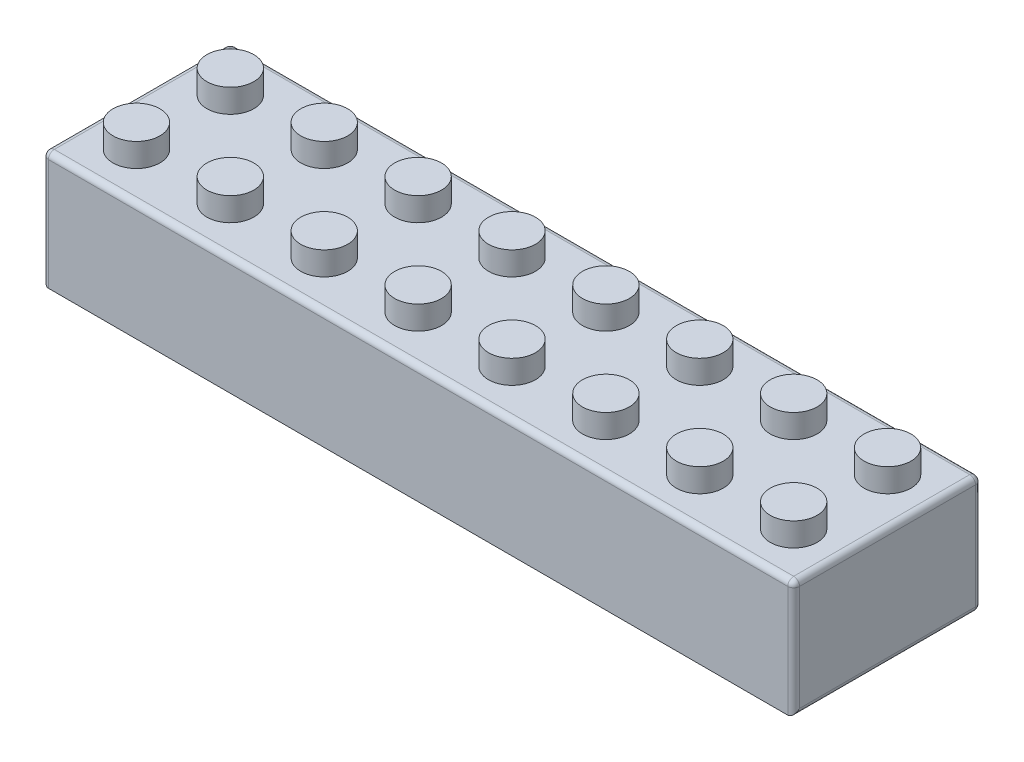
from build123d import *

# Parameters (mm, degrees)
BOSS_EXTRUDE1_DEPTH      = 8
BOSS_EXTRUDE1_DEPTH_BACK = 8
SKETCH1_W                = 64
SKETCH1_H                = 10
SKETCH2_R                = 2
BOSS_EXTRUDE2_DEPTH      = 2
SHELL1_T                 = -1
SKETCH3_R                = 3.772610986
SKETCH3_R_2              = 2.772610986
BOSS_EXTRUDE3_DEPTH      = 9
FILLET1_R                = 0.5


with BuildPart() as part:
    # Sketch1 → Boss-Extrude1 (new, two sides: drawn at the far end of the back side and taken through both)
    with BuildSketch(Plane.XY.offset(-BOSS_EXTRUDE1_DEPTH_BACK)):
        Rectangle(SKETCH1_W, SKETCH1_H)
    extrude(amount=BOSS_EXTRUDE1_DEPTH + BOSS_EXTRUDE1_DEPTH_BACK)

    # Sketch2 → Boss-Extrude2 (add)
    with BuildSketch(Plane(origin=(0, 5, 0), x_dir=(1, 0, 0), z_dir=(0, 1, 0))):
        with Locations((-28, 4)):
            Circle(SKETCH2_R)
        with Locations((-20, 4)):
            Circle(SKETCH2_R)
        with Locations((-12, 4)):
            Circle(SKETCH2_R)
        with Locations((-4, 4)):
            Circle(SKETCH2_R)
        with Locations((4, 4)):
            Circle(SKETCH2_R)
        with Locations((12, 4)):
            Circle(SKETCH2_R)
        with Locations((20, 4)):
            Circle(SKETCH2_R)
        with Locations((28, 4)):
            Circle(SKETCH2_R)
        with Locations((-20, -4)):
            Circle(SKETCH2_R)
        with Locations((-12, -4)):
            Circle(SKETCH2_R)
        with Locations((-4, -4)):
            Circle(SKETCH2_R)
        with Locations((4, -4)):
            Circle(SKETCH2_R)
        with Locations((12, -4)):
            Circle(SKETCH2_R)
        with Locations((20, -4)):
            Circle(SKETCH2_R)
        with Locations((28, -4)):
            Circle(SKETCH2_R)
        with Locations((-28, -4)):
            Circle(SKETCH2_R)
    extrude(amount=BOSS_EXTRUDE2_DEPTH)

    # Shell1
    shell1_openings = [part.faces().sort_by_distance(p)[0] for p in [
        (0, -5, 0),
    ]]
    offset(amount=SHELL1_T, openings=shell1_openings, kind=Kind.INTERSECTION)

    # Sketch3 → Boss-Extrude3 (add)
    with BuildSketch(Plane(origin=(0, 4, 0), x_dir=(-1, 0, 0), z_dir=(0, -1, 0))):
        with Locations((24, 0)):
            Circle(SKETCH3_R)
        with Locations((24, 0)):
            Circle(SKETCH3_R_2, mode=Mode.SUBTRACT)
    extrude(amount=BOSS_EXTRUDE3_DEPTH)

    # Fillet1
    fillet1_edges = [part.edges().sort_by_distance(p)[0] for p in [
        (0, -5, 7),
        (32, -5, 0),
        (0, -5, -8),
        (-32, -5, 0),
        (-32, 5, 0),
        (0, 5, -8),
        (0, 5, 8),
        (32, 5, 0),
        (32, 0, -8),
        (32, 0, 8),
        (-32, 0, -8),
        (-32, 0, 8),
    ]]
    fillet(fillet1_edges, radius=FILLET1_R)


solid = part.part
